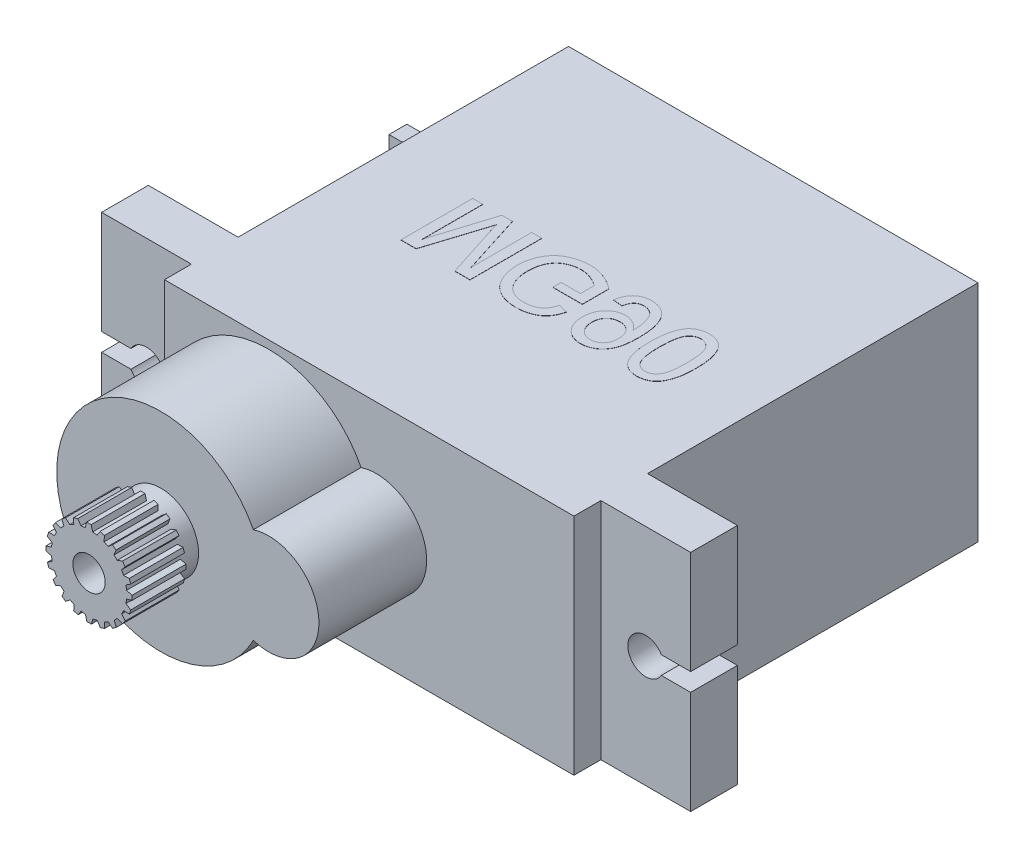
from build123d import *

# Parameters (mm, degrees)
EXTRUDE_1_DEPTH          = 6
SKETCH_2_R               = 2.1
SKETCH_2_R_2             = 0.9
EXTRUDE_2_DEPTH          = 4
EXTRUDE_3_DEPTH          = 3
PATTERN_CIRCULAR_1_COUNT = 20
SKETCH_4_W               = 22.8
SKETCH_4_H               = 12.5
EXTRUDE_4_DEPTH          = 22.5
EXTRUDE_START            = -1.5
EXTRUDE_5_DEPTH          = 2.6
SKETCH_6_W               = 1
SKETCH_6_H               = 4
EXTRUDE_6_DEPTH          = 5
EXTRUDE_7_DEPTH          = 0.01


with BuildPart() as part:
    # Эскиз1 → Бобышка-Вытянуть1 (new body)
    with BuildSketch(Plane.XY):
        with BuildLine():
            ThreePointArc((5.15, 2.667864314), (-5.8, 0), (5.15, -2.667864314))
            ThreePointArc((5.15, -2.667864314), (8.8, 0), (5.15, 2.667864314))
        make_face()
    extrude(amount=EXTRUDE_1_DEPTH)

    # Эскиз2 → Бобышка-Вытянуть2 (add)
    with BuildSketch(Plane.XY.offset(6)):
        Circle(SKETCH_2_R)
        Circle(SKETCH_2_R_2, mode=Mode.SUBTRACT)
    extrude(amount=EXTRUDE_2_DEPTH)

    # Эскиз3 → Бобышка-Вытянуть3 (add)
    with BuildSketch(Plane.XY.offset(10)):
        Polygon((-0.266927961, -1.851726785), (0.279604213, -1.851726785), (0.131338126, -2.396403617), (-0.118661874, -2.397064738), align=None)
    extrude_3 = extrude(amount=-EXTRUDE_3_DEPTH)

    # Круговой массив1: Бобышка-Вытянуть3 ×20 about axis
    pattern_circular_1_axis = Axis((0, 0, 50), (0, 0, -1))
    for i in range(1, PATTERN_CIRCULAR_1_COUNT):
        add(extrude_3.rotate(pattern_circular_1_axis, i * 360 / PATTERN_CIRCULAR_1_COUNT))

    # Эскиз4 → Бобышка-Вытянуть4 (add)
    with BuildSketch(Plane.XY):
        with Locations((5.6, 0)):
            Rectangle(SKETCH_4_W, SKETCH_4_H)
    extrude(amount=-EXTRUDE_4_DEPTH)

    # Эскиз5 → Бобышка-Вытянуть5 (add)
    with BuildSketch(Plane.XY.offset(EXTRUDE_START)):
        with BuildLine():
            Line((-5.8, 6.25), (-10.8, 6.25))
            Line((-10.8, 6.25), (-10.8, 0.5))
            Line((-10.8, 0.5), (-9.166025404, 0.5))
            ThreePointArc((-9.166025404, 0.5), (-7.3, 0), (-9.166025404, -0.5))
            Line((-9.166025404, -0.5), (-10.8, -0.5))
            Line((-10.8, -0.5), (-10.8, -6.25))
            Line((-10.8, -6.25), (-5.8, -6.25))
            Line((-5.8, -6.25), (-5.8, 6.25))
        make_face()
        with BuildLine():
            Line((22, -0.5), (22, -6.25))
            Line((22, -6.25), (17, -6.25))
            Line((17, -6.25), (17, 6.25))
            Line((17, 6.25), (22, 6.25))
            Line((22, 6.25), (22, 0.5))
            Line((22, 0.5), (20.366025404, 0.5))
            ThreePointArc((20.366025404, 0.5), (18.5, 0), (20.366025404, -0.5))
            Line((20.366025404, -0.5), (22, -0.5))
        make_face()
    extrude(amount=-EXTRUDE_5_DEPTH)

    # Эскиз6 → Бобышка-Вытянуть6 (add)
    with BuildSketch(Plane.ZY.offset(5.8)):
        with Locations((-18, 0)):
            Rectangle(SKETCH_6_W, SKETCH_6_H)
    extrude(amount=EXTRUDE_6_DEPTH)

    # Эскиз7 → Бобышка-Вытянуть7 (add)
    # profile 1 of 4: a face of its own
    with BuildSketch(Plane.XZ.offset(6.25)):
        with BuildLine():
            Line((-1.12827662, -12.492232593), (-1.12827662, -8.492232593))
            Line((-1.12827662, -8.492232593), (-0.279718928, -8.492232593))
            Line((-0.279718928, -8.492232593), (0.614511841, -11.299123619))
            add(Edge.make_bspline(
                [(0.614511841, -11.299123619), (0.624352889, -11.330920802), (0.643384902, -11.392414705), (0.67160712, -11.481217558), (0.697284607, -11.563739905), (0.720411227, -11.640244418), (0.742236117, -11.710351257), (0.761133033, -11.774635699), (0.7791991, -11.832383401), (0.789786622, -11.869083955), (0.794800303, -11.886463362)],
                knots=[0, 0, 0, 0, 1.300204174, 2.514519184, 3.639827924, 4.676153899, 5.636536826, 6.507959918, 7.293450077, 8, 8, 8, 8], degree=3))
            add(Edge.make_bspline(
                [(0.794800303, -11.886463362), (0.800384379, -11.867492219), (0.812267651, -11.827120413), (0.831532334, -11.763642668), (0.852030506, -11.693397401), (0.876560533, -11.617592012), (0.902130184, -11.535037354), (0.928968861, -11.445801985), (0.959926752, -11.350776814), (0.980499817, -11.284989427), (0.991114406, -11.251046696)],
                knots=[0, 0, 0, 0, 0.713638162, 1.518667645, 2.393860736, 3.354087503, 4.393659122, 5.512594909, 6.716633584, 8, 8, 8, 8], degree=3))
            Line((0.991114406, -11.251046696), (1.876531072, -8.492232593))
            Line((1.876531072, -8.492232593), (2.717877226, -8.492232593))
            Line((2.717877226, -8.492232593), (2.717877226, -12.492232593))
            Line((2.717877226, -12.492232593), (2.153774662, -12.492232593))
            Line((2.153774662, -12.492232593), (2.153774662, -9.107617208))
            Line((2.153774662, -9.107617208), (1.08646697, -12.492232593))
            Line((1.08646697, -12.492232593), (0.49672338, -12.492232593))
            Line((0.49672338, -12.492232593), (-0.564174056, -9.107617208))
            Line((-0.564174056, -9.107617208), (-0.564174056, -12.492232593))
            Line((-0.564174056, -12.492232593), (-1.12827662, -12.492232593))
        make_face()
    # profile 2 of 4: a face of its own
    with BuildSketch(Plane.XZ.offset(6.25)):
        with BuildLine():
            Line((5.384543893, -10.902489003), (5.384543893, -10.440950542))
            Line((5.384543893, -10.440950542), (7.025569534, -10.440950542))
            Line((7.025569534, -10.440950542), (7.025569534, -11.920918491))
            add(Edge.make_bspline(
                [(7.025569534, -11.920918491), (6.960822759, -11.970231453), (6.833393071, -12.067285483), (6.633545589, -12.193857694), (6.430420268, -12.301205974), (6.224578474, -12.389829222), (6.015312702, -12.458228691), (5.803526418, -12.507187422), (5.588988989, -12.538197334), (5.444743128, -12.541740643), (5.372524662, -12.543514644)],
                knots=[0, 0, 0, 0, 1.08433114, 2.134098231, 3.14842993, 4.143565882, 5.117308249, 6.078377492, 7.037916032, 8, 8, 8, 8], degree=3))
            add(Edge.make_bspline(
                [(5.372524662, -12.543514644), (5.324153263, -12.542772101), (5.228061799, -12.541297013), (5.085793504, -12.528677567), (4.946847177, -12.509926863), (4.811486369, -12.482354964), (4.679233202, -12.447252912), (4.550342412, -12.403873055), (4.424759973, -12.353252066), (4.303185917, -12.295217341), (4.187447575, -12.228724423), (4.077863418, -12.155820176), (3.97581588, -12.075406313), (3.881147888, -11.988140574), (3.794201738, -11.893503783), (3.713689208, -11.792753739), (3.64176991, -11.684044249), (3.576855748, -11.569374939), (3.519536311, -11.449613546), (3.469488612, -11.325782087), (3.42811945, -11.198177632), (3.393617016, -11.067364691), (3.36617883, -10.933392565), (3.347014107, -10.795841374), (3.335732821, -10.65481632), (3.334090893, -10.559560503), (3.333261841, -10.511463362)],
                knots=[0, 0, 0, 0, 1.072770755, 2.131096365, 3.165876834, 4.181397123, 5.193125461, 6.199217581, 7.195986042, 8.195005739, 9.184865672, 10.154356418, 11.112044544, 12.063776475, 13.007136321, 13.960176652, 14.921449994, 15.895149614, 16.88092309, 17.86448639, 18.855604391, 19.854360534, 20.864074582, 21.88711945, 22.933151623, 24, 24, 24, 24], degree=3))
            add(Edge.make_bspline(
                [(3.333261841, -10.511463362), (3.334093174, -10.463633322), (3.335744167, -10.368644705), (3.347121819, -10.227097452), (3.366356762, -10.088028545), (3.39291137, -9.951358459), (3.426423225, -9.817205744), (3.468171712, -9.685544432), (3.518120248, -9.556495131), (3.57469032, -9.430330553), (3.637695566, -9.308855879), (3.710051023, -9.195953242), (3.786123603, -9.088984652), (3.872189512, -8.992600431), (3.962258693, -8.901824111), (4.060738166, -8.821031392), (4.165145701, -8.747790221), (4.275932861, -8.682887778), (4.392447957, -8.626246996), (4.513300594, -8.576363139), (4.638765055, -8.534968835), (4.768122217, -8.500045238), (4.902088863, -8.474096456), (5.040319684, -8.454576657), (5.182970871, -8.443427525), (5.279557426, -8.441783052), (5.328454149, -8.440950542)],
                knots=[0, 0, 0, 0, 1.059979929, 2.105079288, 3.144800512, 4.169876923, 5.189194625, 6.207600986, 7.228841866, 8.254191695, 9.270945245, 10.257936415, 11.22408152, 12.176290364, 13.118065146, 14.055588944, 14.994904974, 15.942096138, 16.897776019, 17.864011786, 18.837383209, 19.823806203, 20.831455606, 21.859450402, 22.916351634, 24, 24, 24, 24], degree=3))
            add(Edge.make_bspline(
                [(5.328454149, -8.440950542), (5.399041229, -8.442648739), (5.536959073, -8.445966793), (5.738879819, -8.471772927), (5.929848857, -8.515930818), (6.081190236, -8.566663499), (6.194859695, -8.616103217), (6.275207424, -8.656060475), (6.350732767, -8.69969325), (6.422305082, -8.745583608), (6.488326178, -8.796742878), (6.549663574, -8.850765447), (6.606478683, -8.908299037), (6.676426422, -8.990410524), (6.756443648, -9.104471496), (6.836730577, -9.259359702), (6.907052102, -9.432018113), (6.94185675, -9.555663349), (6.959864406, -9.619636439)],
                knots=[0, 0, 0, 0, 1.539867261, 3.008697525, 4.432261777, 5.810773619, 6.484177873, 7.135742803, 7.767512201, 8.386601754, 8.989234153, 9.587908519, 10.168964172, 10.7517707, 11.940093668, 13.199243526, 14.550910222, 16, 16, 16, 16], degree=3))
            Line((6.959864406, -9.619636439), (6.443838765, -9.749444132))
            add(Edge.make_bspline(
                [(6.443838765, -9.749444132), (6.428944968, -9.701973853), (6.400420029, -9.611057687), (6.35017649, -9.483988726), (6.291646998, -9.374265698), (6.22906455, -9.277684897), (6.15450709, -9.194602266), (6.067942946, -9.120985293), (5.96678017, -9.057051385), (5.853246421, -9.002311377), (5.729815296, -8.957611529), (5.598443414, -8.925757587), (5.460468357, -8.905946998), (5.366182614, -8.903657891), (5.318037482, -8.902489003)],
                knots=[0, 0, 0, 0, 1.164883671, 2.23101188, 3.193404931, 4.072828119, 4.918883984, 5.797350418, 6.725503451, 7.712871826, 8.743577122, 9.793233972, 10.87315899, 12, 12, 12, 12], degree=3))
            add(Edge.make_bspline(
                [(5.318037482, -8.902489003), (5.261088294, -8.903924599), (5.150827679, -8.90670409), (4.991044562, -8.926629362), (4.843181524, -8.96062035), (4.707734163, -9.009054641), (4.585271348, -9.0685906), (4.474040912, -9.1359126), (4.375928494, -9.212984421), (4.290561159, -9.298822976), (4.216320144, -9.39064942), (4.150117438, -9.486364987), (4.092545591, -9.586741907), (4.061795528, -9.657255756), (4.046402867, -9.692553106)],
                knots=[0, 0, 0, 0, 1.282088634, 2.482280855, 3.618640035, 4.691464057, 5.71354971, 6.679981643, 7.61357903, 8.515091979, 9.399860987, 10.268958177, 11.133486685, 12, 12, 12, 12], degree=3))
            add(Edge.make_bspline(
                [(4.046402867, -9.692553106), (4.023417177, -9.754634886), (3.97715098, -9.879594713), (3.931953467, -10.076535044), (3.902777864, -10.280882194), (3.89918699, -10.420012871), (3.897364406, -10.490630029)],
                knots=[0, 0, 0, 0, 0.971932623, 1.956331326, 2.96271565, 4, 4, 4, 4], degree=3))
            add(Edge.make_bspline(
                [(3.897364406, -10.490630029), (3.897640614, -10.533920152), (3.898181715, -10.618726892), (3.907880057, -10.74324711), (3.920560951, -10.862697814), (3.941141369, -10.976493217), (3.965609604, -11.084972482), (3.995958821, -11.188194939), (4.033056185, -11.285645378), (4.074491662, -11.378278076), (4.121900975, -11.465092402), (4.174696392, -11.5459959), (4.232681958, -11.620945416), (4.295659937, -11.690023631), (4.362696112, -11.754618152), (4.435889931, -11.812263994), (4.514418328, -11.8637984), (4.624590483, -11.92516961), (4.769855867, -11.987124504), (4.949922379, -12.042400638), (5.136023332, -12.075230543), (5.261821066, -12.079715062), (5.325249021, -12.081976183)],
                knots=[0, 0, 0, 0, 1.070760406, 2.097653971, 3.088708526, 4.041547766, 4.95691435, 5.839291284, 6.700934147, 7.534993757, 8.348268852, 9.145600082, 9.922850605, 10.690119832, 11.456705726, 12.223547942, 12.991528328, 13.778467112, 15.341275849, 16.888285822, 18.431055468, 20, 20, 20, 20], degree=3))
            add(Edge.make_bspline(
                [(5.325249021, -12.081976183), (5.380889196, -12.080145043), (5.4919131, -12.076491204), (5.657204562, -12.051136383), (5.819897449, -12.008083032), (5.977195787, -11.949956202), (6.124338088, -11.883376757), (6.254584243, -11.812036968), (6.367685454, -11.740851546), (6.431304741, -11.686344088), (6.46146697, -11.660501824)],
                knots=[0, 0, 0, 0, 1.08078364, 2.156585965, 3.240205791, 4.344938036, 5.41078367, 6.374425311, 7.229306744, 8, 8, 8, 8], degree=3))
            Line((6.46146697, -11.660501824), (6.46146697, -10.902489003))
            Line((6.46146697, -10.902489003), (5.384543893, -10.902489003))
        make_face()
    # profile 3 of 4: a face of its own
    with BuildSketch(Plane.XZ.offset(6.25)):
        with BuildLine():
            Line((7.6922362, -11.517873619), (8.205056713, -11.466591567))
            add(Edge.make_bspline(
                [(8.205056713, -11.466591567), (8.209692917, -11.492866472), (8.218655091, -11.543658091), (8.238879894, -11.616044853), (8.259392806, -11.683538498), (8.285872211, -11.744635429), (8.313448581, -11.800995209), (8.344678064, -11.852053069), (8.380117063, -11.896783527), (8.430161584, -11.949199652), (8.501167473, -12.003896767), (8.599591258, -12.048203563), (8.707866666, -12.077994149), (8.784171015, -12.080618497), (8.823646457, -12.081976183)],
                knots=[0, 0, 0, 0, 0.994516507, 1.922484754, 2.80151264, 3.623050913, 4.402748861, 5.140924173, 5.850441436, 6.526872911, 7.841975818, 9.161260782, 10.53140107, 12, 12, 12, 12], degree=3))
            add(Edge.make_bspline(
                [(8.823646457, -12.081976183), (8.858187852, -12.080732316), (8.926170673, -12.078284193), (9.025291876, -12.059306147), (9.1195546, -12.028903715), (9.207317993, -11.985282591), (9.288262641, -11.932196901), (9.358965062, -11.869120408), (9.420369352, -11.798769739), (9.470801349, -11.717712269), (9.513846421, -11.625131034), (9.554518287, -11.519848591), (9.592993199, -11.400051108), (9.627187438, -11.267266559), (9.657806706, -11.126342668), (9.679295012, -10.980472621), (9.692515929, -10.832492356), (9.693930267, -10.732911817), (9.694640047, -10.682937721)],
                knots=[0, 0, 0, 0, 0.897794352, 1.766998465, 2.614902619, 3.466100941, 4.308008728, 5.124841802, 5.922729683, 6.728261092, 7.598214292, 8.574707161, 9.662086263, 10.868425066, 12.139522319, 13.41071447, 14.70057738, 16, 16, 16, 16], degree=3))
            add(Edge.make_bspline(
                [(9.694640047, -10.682937721), (9.694397308, -10.669315345), (9.693816572, -10.636724606), (9.692817612, -10.604143858), (9.6922362, -10.585181311)],
                knots=[0, 0, 0, 0, 0.835966126, 2, 2, 2, 2], degree=3))
            add(Edge.make_bspline(
                [(9.6922362, -10.585181311), (9.667513937, -10.622723864), (9.618109246, -10.697748476), (9.527093603, -10.798440586), (9.422970108, -10.887755855), (9.307319284, -10.965000741), (9.182996821, -11.028394085), (9.052165542, -11.074458255), (8.915953261, -11.102902276), (8.823249366, -11.106033706), (8.776370816, -11.107617208)],
                knots=[0, 0, 0, 0, 0.978840568, 1.956103883, 2.947027447, 3.962820877, 4.980997961, 5.980964245, 6.979013046, 8, 8, 8, 8], degree=3))
            add(Edge.make_bspline(
                [(8.776370816, -11.107617208), (8.737305201, -11.106605061), (8.660403787, -11.10461263), (8.547756747, -11.086904533), (8.439412372, -11.060348665), (8.336397349, -11.020141795), (8.237108909, -10.970416244), (8.14258958, -10.909381941), (8.052693718, -10.837121964), (7.96858292, -10.754536071), (7.891824418, -10.662483286), (7.824132277, -10.563206187), (7.767920816, -10.456219345), (7.721150934, -10.342858108), (7.685063046, -10.222027176), (7.659986688, -10.094009668), (7.643121634, -9.959294264), (7.641686228, -9.8670188), (7.640954149, -9.819956952)],
                knots=[0, 0, 0, 0, 0.975490236, 1.920271282, 2.842894855, 3.757591483, 4.67685385, 5.613562631, 6.563069669, 7.554119451, 8.55387214, 9.553424333, 10.550567425, 11.568071726, 12.613215376, 13.695622473, 14.824733476, 16, 16, 16, 16], degree=3))
            add(Edge.make_bspline(
                [(7.640954149, -9.819956952), (7.642050612, -9.771300908), (7.644195484, -9.676121248), (7.660397406, -9.536956764), (7.68720202, -9.405115733), (7.72629285, -9.280849805), (7.774635138, -9.163360538), (7.835592887, -9.053495006), (7.906818865, -8.950783236), (7.98873864, -8.856215458), (8.078767732, -8.771361985), (8.174352563, -8.695628783), (8.27673868, -8.633376453), (8.383962916, -8.581473539), (8.496836716, -8.541362184), (8.615167165, -8.512370104), (8.739281702, -8.495358457), (8.823861013, -8.493287038), (8.866915688, -8.492232593)],
                knots=[0, 0, 0, 0, 1.151671969, 2.252870106, 3.311924673, 4.331900944, 5.332425074, 6.314476151, 7.300265758, 8.286521684, 9.270545387, 10.225535917, 11.167946231, 12.101233205, 13.04124339, 13.998220545, 14.981004193, 16, 16, 16, 16], degree=3))
            add(Edge.make_bspline(
                [(8.866915688, -8.492232593), (8.898185787, -8.492865021), (8.960340289, -8.494122075), (9.052839091, -8.50371927), (9.143147534, -8.521019786), (9.231854419, -8.542857899), (9.317463508, -8.573170847), (9.401625048, -8.608224667), (9.48332393, -8.651098141), (9.563036202, -8.699850653), (9.640261211, -8.753625226), (9.71131267, -8.815406392), (9.779030467, -8.880970697), (9.842036632, -8.952375852), (9.898338289, -9.030723875), (9.951757736, -9.113244777), (9.99971989, -9.201739191), (10.043458043, -9.29632697), (10.082386697, -9.398955174), (10.114862947, -9.511891775), (10.142702339, -9.63552794), (10.165881378, -9.77002755), (10.183069014, -9.915294717), (10.19571811, -10.071113546), (10.20399893, -10.237602558), (10.204697189, -10.352264998), (10.205056713, -10.411303106)],
                knots=[0, 0, 0, 0, 0.850689348, 1.69088598, 2.526071361, 3.350886897, 4.173587108, 4.994166539, 5.82944675, 6.680632524, 7.535501428, 8.385942454, 9.238956306, 10.098905971, 10.972410977, 11.861345628, 12.77184846, 13.708225841, 14.694799433, 15.754852217, 16.902446579, 18.141290626, 19.466225842, 20.880733292, 22.39393263, 24, 24, 24, 24], degree=3))
            add(Edge.make_bspline(
                [(10.205056713, -10.411303106), (10.204694783, -10.473011735), (10.203989395, -10.59327937), (10.195643565, -10.768839595), (10.183000828, -10.934796415), (10.165801047, -11.091258817), (10.142460422, -11.237988004), (10.114718233, -11.374958326), (10.08200105, -11.502422652), (10.043553595, -11.620392173), (9.999846266, -11.730222599), (9.951955945, -11.833266332), (9.898321439, -11.929370988), (9.839545384, -12.018720874), (9.776382503, -12.101472163), (9.707846608, -12.177403176), (9.633915445, -12.246284385), (9.555531398, -12.308890981), (9.472812101, -12.364063113), (9.386883652, -12.412745659), (9.296776297, -12.452625184), (9.203416364, -12.485340914), (9.106969754, -12.512353058), (9.006650893, -12.530553889), (8.902923255, -12.540862218), (8.832750147, -12.542622817), (8.797204149, -12.543514644)],
                knots=[0, 0, 0, 0, 1.538356107, 2.998194159, 4.380716326, 5.687456969, 6.921258146, 8.08355215, 9.170518603, 10.200253214, 11.174652363, 12.115998813, 13.031191965, 13.915860606, 14.780247615, 15.624154577, 16.462764255, 17.29681422, 18.1223677, 18.939254916, 19.756006416, 20.575278551, 21.404021733, 22.250368457, 23.113728878, 24, 24, 24, 24], degree=3))
            add(Edge.make_bspline(
                [(8.797204149, -12.543514644), (8.759501396, -12.542862761), (8.685735806, -12.541587347), (8.578045633, -12.528176287), (8.475456448, -12.507787104), (8.378266819, -12.477687841), (8.285748889, -12.440636457), (8.19948176, -12.393286896), (8.117932352, -12.338659668), (8.042106736, -12.275653169), (7.972892725, -12.204498776), (7.910267272, -12.126950115), (7.855363201, -12.0420028), (7.808467844, -11.950157653), (7.766929436, -11.852187373), (7.734725873, -11.746778239), (7.708563576, -11.634902435), (7.697766545, -11.557513163), (7.6922362, -11.517873619)],
                knots=[0, 0, 0, 0, 1.08199657, 2.11693069, 3.111083497, 4.081436044, 5.034173265, 5.967546613, 6.901297947, 7.84883568, 8.792454994, 9.747011506, 10.706361727, 11.690764787, 12.70483191, 13.757514363, 14.851376857, 16, 16, 16, 16], degree=3))
        make_face()
        with BuildLine():
            add(Edge.make_bspline(
                [(9.6922362, -9.808739003), (9.691659435, -9.776662275), (9.690536798, -9.714226982), (9.680701133, -9.623134665), (9.664875613, -9.537352761), (9.642663327, -9.456388011), (9.612498383, -9.381098672), (9.577554352, -9.30972694), (9.534821319, -9.244251026), (9.486604594, -9.18378925), (9.433492899, -9.129707587), (9.375654752, -9.082553213), (9.314174574, -9.042131225), (9.247577449, -9.010348671), (9.178052639, -8.984159961), (9.10393006, -8.967044038), (9.026229633, -8.955053993), (8.972733786, -8.954204466), (8.945441329, -8.953771055)],
                knots=[0, 0, 0, 0, 1.20361398, 2.342757417, 3.433960756, 4.474970456, 5.487648377, 6.473933575, 7.452701285, 8.415527761, 9.372491588, 10.291530068, 11.211879743, 12.12647906, 13.055739058, 13.994253148, 14.97671008, 16, 16, 16, 16], degree=3))
            add(Edge.make_bspline(
                [(8.945441329, -8.953771055), (8.917368526, -8.954621737), (8.862065033, -8.956297583), (8.781006764, -8.967090107), (8.704132983, -8.987754467), (8.630924704, -9.015165272), (8.560568844, -9.049071954), (8.495623117, -9.093500072), (8.433367369, -9.14384814), (8.37629858, -9.202258604), (8.324168124, -9.266299368), (8.278235446, -9.335369336), (8.239554312, -9.40950235), (8.20863357, -9.488389328), (8.183364177, -9.571342685), (8.1660059, -9.659104153), (8.155325106, -9.751580302), (8.154299179, -9.814852084), (8.153774662, -9.847200542)],
                knots=[0, 0, 0, 0, 1.007165334, 1.984118292, 2.925321257, 3.856078893, 4.785899085, 5.718627206, 6.671847665, 7.654235469, 8.641842333, 9.630378272, 10.624608936, 11.635186472, 12.665777387, 13.731187195, 14.840042241, 16, 16, 16, 16], degree=3))
            add(Edge.make_bspline(
                [(8.153774662, -9.847200542), (8.154259094, -9.876088822), (8.155208875, -9.932727508), (8.166519731, -10.015386512), (8.181606734, -10.094276979), (8.205658267, -10.16859364), (8.234633378, -10.239415428), (8.272292111, -10.305115813), (8.314692258, -10.367659368), (8.36437224, -10.424950873), (8.419293567, -10.476924313), (8.479278804, -10.52222476), (8.543570275, -10.561002729), (8.612765275, -10.592213498), (8.686448849, -10.61625038), (8.764456526, -10.633946375), (8.847127387, -10.644486548), (8.903743864, -10.645540953), (8.932620816, -10.646078747)],
                knots=[0, 0, 0, 0, 1.102204012, 2.160993585, 3.181057555, 4.164839289, 5.138418409, 6.097303793, 7.050641095, 8.019669129, 8.986440483, 9.932879371, 10.884360123, 11.847412593, 12.824617322, 13.839006415, 14.897795988, 16, 16, 16, 16], degree=3))
            add(Edge.make_bspline(
                [(8.932620816, -10.646078747), (8.959630109, -10.645535697), (9.01279044, -10.644466854), (9.090664739, -10.633881749), (9.164659962, -10.616152937), (9.235108339, -10.59204987), (9.301895685, -10.560849892), (9.364572895, -10.521763762), (9.424351563, -10.47698098), (9.479479351, -10.424654484), (9.529864131, -10.366718821), (9.573437597, -10.302601636), (9.610646999, -10.233467317), (9.639934586, -10.158496391), (9.663392554, -10.078611883), (9.679908522, -9.993308034), (9.690724539, -9.902766941), (9.691724692, -9.84055568), (9.6922362, -9.808739003)],
                knots=[0, 0, 0, 0, 1.017004716, 2.00169281, 2.953445817, 3.879374072, 4.80207141, 5.723561102, 6.657273834, 7.611045633, 8.581233951, 9.544037932, 10.525327521, 11.53237926, 12.57032081, 13.657564536, 14.802009319, 16, 16, 16, 16], degree=3))
        make_face(mode=Mode.SUBTRACT)
    # profile 4 of 4: a face of its own
    with BuildSketch(Plane.XZ.offset(6.25)):
        with BuildLine():
            add(Edge.make_bspline(
                [(10.717877226, -10.519476183), (10.718393893, -10.462312511), (10.719405825, -10.350352951), (10.725682515, -10.186536001), (10.736641106, -10.030965827), (10.752999266, -9.883777534), (10.772370392, -9.744638889), (10.797552978, -9.613748457), (10.825887048, -9.490812565), (10.859882847, -9.375959354), (10.897233102, -9.268201294), (10.939608157, -9.167711254), (10.987285843, -9.074595778), (11.037923097, -8.987889205), (11.094185568, -8.908940179), (11.152677367, -8.835533069), (11.217649327, -8.770359998), (11.286399776, -8.711744057), (11.359941082, -8.660018906), (11.437884138, -8.61538634), (11.51992904, -8.575979002), (11.607639473, -8.546313168), (11.699194587, -8.522129224), (11.795299124, -8.504339222), (11.89605899, -8.493851416), (11.964914195, -8.492778297), (11.999928508, -8.492232593)],
                knots=[0, 0, 0, 0, 1.514747001, 2.966751498, 4.343369068, 5.64627492, 6.890416844, 8.064737671, 9.177176366, 10.232018008, 11.237056675, 12.19799043, 13.119080079, 14.007588942, 14.855863561, 15.685992447, 16.491747269, 17.290132607, 18.077525251, 18.870243746, 19.668095604, 20.485086593, 21.319398728, 22.175900658, 23.072407314, 24, 24, 24, 24], degree=3))
            add(Edge.make_bspline(
                [(11.999928508, -8.492232593), (12.051299059, -8.493742851), (12.152218567, -8.496709813), (12.299561569, -8.520907818), (12.438422852, -8.562302234), (12.568712199, -8.618145087), (12.688202333, -8.689076258), (12.79491206, -8.775303904), (12.887690341, -8.87592265), (12.965524647, -8.992124797), (13.033559599, -9.120704712), (13.094000357, -9.26223951), (13.148637046, -9.416570586), (13.187408431, -9.554718443), (13.215064027, -9.673972576), (13.233369835, -9.772330011), (13.248567325, -9.878458237), (13.260210657, -9.992100501), (13.269763735, -10.113129344), (13.27714114, -10.24162012), (13.280885929, -10.37789397), (13.281608334, -10.471397374), (13.28197979, -10.519476183)],
                knots=[0, 0, 0, 0, 1.134486744, 2.228744715, 3.287356444, 4.328707449, 5.352829806, 6.347195599, 7.349461267, 8.364207941, 9.428085653, 10.559314403, 11.761222316, 13.04268526, 13.726896727, 14.465273606, 15.252205015, 16.094778733, 16.988606776, 17.934225168, 18.937792761, 20, 20, 20, 20], degree=3))
            add(Edge.make_bspline(
                [(13.28197979, -10.519476183), (13.281453445, -10.576371348), (13.280425127, -10.687527253), (13.274316625, -10.850030667), (13.262697701, -11.00442714), (13.248400404, -11.15107035), (13.226771588, -11.289568827), (13.203465367, -11.420511016), (13.174641329, -11.543302324), (13.141010443, -11.657996566), (13.103134429, -11.765200205), (13.061597519, -11.865723427), (13.015591402, -11.959497541), (12.963746763, -12.045607924), (12.90843573, -12.125197545), (12.849253207, -12.198564964), (12.784944455, -12.264654212), (12.715574458, -12.323094335), (12.642549505, -12.375736758), (12.564416955, -12.420809983), (12.481518783, -12.458152367), (12.394408864, -12.49007825), (12.30220334, -12.513471664), (12.205629338, -12.531378957), (12.104331026, -12.541924068), (12.035209495, -12.542977137), (11.999928508, -12.543514644)],
                knots=[0, 0, 0, 0, 1.508974709, 2.94807912, 4.311757619, 5.615040294, 6.854280449, 8.028314546, 9.141715822, 10.197470207, 11.196696834, 12.155719058, 13.080757287, 13.963948316, 14.818758719, 15.649605906, 16.461113142, 17.260189315, 18.052359509, 18.845763934, 19.647754795, 20.461145776, 21.303032214, 22.167241874, 23.064524267, 24, 24, 24, 24], degree=3))
            add(Edge.make_bspline(
                [(11.999928508, -12.543514644), (11.953671044, -12.542195148), (11.86348172, -12.539622493), (11.731766864, -12.522142885), (11.608145445, -12.491377955), (11.491574788, -12.450117846), (11.38336518, -12.394930073), (11.282999962, -12.327783372), (11.188462368, -12.250239981), (11.134040782, -12.189060025), (11.106499021, -12.158097978)],
                knots=[0, 0, 0, 0, 1.10322584, 2.150986741, 3.161425019, 4.136713905, 5.093944212, 6.049774532, 7.013026876, 8, 8, 8, 8], degree=3))
            add(Edge.make_bspline(
                [(11.106499021, -12.158097978), (11.074797821, -12.112368531), (11.009428589, -12.018072456), (10.932919571, -11.8572889), (10.864672173, -11.680288779), (10.811110478, -11.483599372), (10.769158319, -11.268786104), (10.738858386, -11.035427467), (10.721711607, -10.783624277), (10.719184206, -10.609513211), (10.717877226, -10.519476183)],
                knots=[0, 0, 0, 0, 0.779365345, 1.607084704, 2.489375761, 3.438383567, 4.461919411, 5.557722155, 6.737039282, 8, 8, 8, 8], degree=3))
        make_face()
        with BuildLine():
            add(Edge.make_bspline(
                [(11.230697739, -10.517873619), (11.231206929, -10.594808168), (11.232181631, -10.742077911), (11.242364904, -10.952478149), (11.259894989, -11.142287883), (11.283070906, -11.311244309), (11.3136725, -11.459575975), (11.352096421, -11.586904886), (11.395409319, -11.694759277), (11.44900821, -11.781802376), (11.507693075, -11.8527552), (11.568281187, -11.913776923), (11.632197976, -11.96564399), (11.699026392, -12.008890546), (11.769803325, -12.041633998), (11.843754843, -12.065366524), (11.920897036, -12.079024229), (11.973434375, -12.080986584), (11.999928508, -12.081976183)],
                knots=[0, 0, 0, 0, 1.89448813, 3.626469325, 5.185477471, 6.587276848, 7.82441448, 8.910550357, 9.859733512, 10.6775885, 11.416198291, 12.123144072, 12.791880183, 13.439617036, 14.078171869, 14.70637855, 15.347637704, 16, 16, 16, 16], degree=3))
            add(Edge.make_bspline(
                [(11.999928508, -12.081976183), (12.026416007, -12.080964961), (12.07894019, -12.078959728), (12.156260627, -12.065603189), (12.229924416, -12.040648929), (12.300595822, -12.008021127), (12.367909966, -11.96576029), (12.431512841, -11.913697309), (12.492420119, -11.852711818), (12.550841373, -11.780934297), (12.604031915, -11.693488769), (12.64815731, -11.585722236), (12.685982415, -11.458170335), (12.716751926, -11.309914243), (12.740023448, -11.141224949), (12.757447544, -10.951941662), (12.767698965, -10.741812141), (12.768657582, -10.594808515), (12.769159277, -10.517873619)],
                knots=[0, 0, 0, 0, 0.652509534, 1.29391342, 1.924290653, 2.562989607, 3.207355802, 3.876242846, 4.583348185, 5.32723334, 6.150888545, 7.094226006, 8.186903555, 9.424320409, 10.81992305, 12.379283064, 14.105084285, 16, 16, 16, 16], degree=3))
            add(Edge.make_bspline(
                [(12.769159277, -10.517873619), (12.768673645, -10.442539489), (12.767743193, -10.298202147), (12.757227373, -10.091855276), (12.740748138, -9.905231421), (12.718207163, -9.738158532), (12.688250211, -9.590817991), (12.651916514, -9.46289613), (12.608619482, -9.354665762), (12.557139466, -9.265039711), (12.499831907, -9.191522034), (12.439968729, -9.127886089), (12.376053347, -9.07376579), (12.306953372, -9.030349688), (12.234896026, -8.995323192), (12.158225615, -8.971217065), (12.077695748, -8.956407015), (12.022429146, -8.954659747), (11.994319534, -8.953771055)],
                knots=[0, 0, 0, 0, 1.850066095, 3.544656626, 5.0727657, 6.45041401, 7.682899467, 8.762389858, 9.712573485, 10.538438529, 11.291566246, 11.996865408, 12.681389046, 13.341983376, 13.996294293, 14.643563182, 15.31009126, 16, 16, 16, 16], degree=3))
            add(Edge.make_bspline(
                [(11.994319534, -8.953771055), (11.967827065, -8.954466377), (11.91558731, -8.955837465), (11.839101468, -8.96892448), (11.766616734, -8.990808885), (11.697302668, -9.020453438), (11.632889657, -9.06034915), (11.570823243, -9.106930234), (11.514010376, -9.163684086), (11.47977544, -9.206112378), (11.462268252, -9.227809516)],
                knots=[0, 0, 0, 0, 1.021318143, 2.013908504, 2.982026795, 3.937174072, 4.91255697, 5.897578595, 6.924855925, 8, 8, 8, 8], degree=3))
            add(Edge.make_bspline(
                [(11.462268252, -9.227809516), (11.443208264, -9.259675892), (11.402957584, -9.326970967), (11.357919413, -9.44393258), (11.318134474, -9.577597442), (11.285378278, -9.730022081), (11.261681468, -9.90094503), (11.242973753, -10.090167794), (11.233255792, -10.297954549), (11.231573949, -10.442544716), (11.230697739, -10.517873619)],
                knots=[0, 0, 0, 0, 0.671104906, 1.417232262, 2.260109084, 3.195198885, 4.23592645, 5.382417421, 6.636286093, 8, 8, 8, 8], degree=3))
        make_face(mode=Mode.SUBTRACT)
    extrude_7 = extrude(amount=EXTRUDE_7_DEPTH)

    # Зеркальное отражение2: Бобышка-Вытянуть7 across plane
    add(extrude_7.mirror(Plane.ZX))


solid = part.part
